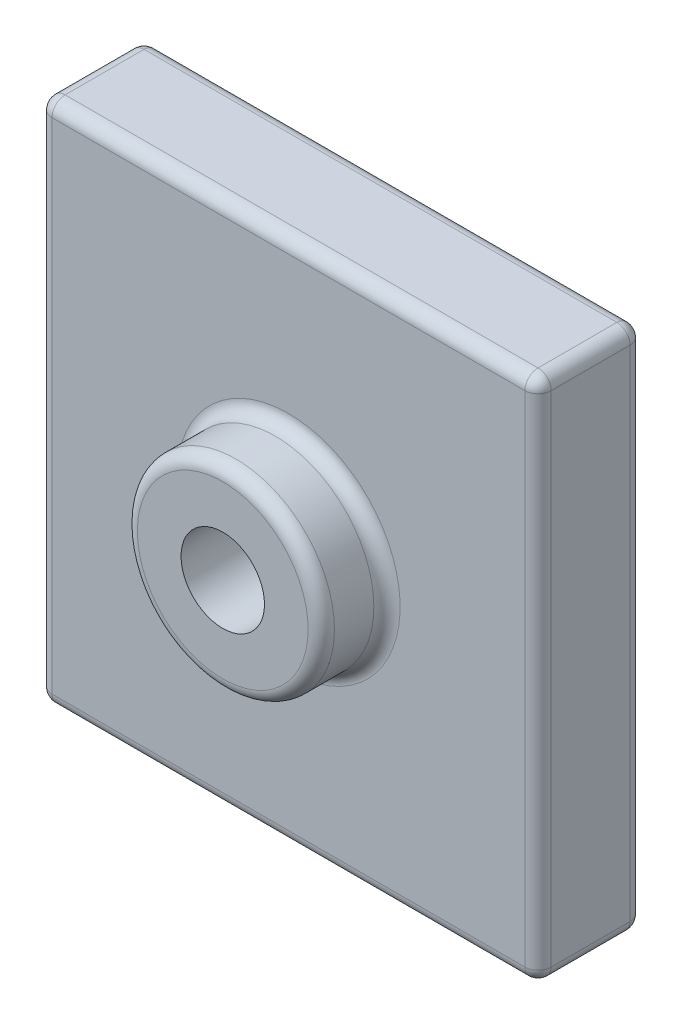
from build123d import *
from build123d.topology import SkipClean

# Parameters (mm, degrees)
SKETCH1_W           = 38
SKETCH1_H           = 40
BOSS_EXTRUDE1_DEPTH = 8
SKETCH2_R           = 7.5
SKETCH2_R_2         = 3.175
BOSS_EXTRUDE2_DEPTH = 5
FILLET1_R           = 1
CUT_EXTRUDE1_DEPTH  = 5.55625
SKETCH4_R           = 3.175
CUT_EXTRUDE2_DEPTH  = 57.683330883


with BuildPart() as part:
    # Sketch1 → Boss-Extrude1 (new body)
    with BuildSketch(Plane.XY):
        with Locations((19, 20)):
            Rectangle(SKETCH1_W, SKETCH1_H)
    extrude(amount=BOSS_EXTRUDE1_DEPTH)

    # Sketch2 → Boss-Extrude2 (add)
    with BuildSketch(Plane.XY.offset(8)):
        with Locations((19, 20)):
            Circle(SKETCH2_R)
        with Locations((19, 20)):
            Circle(SKETCH2_R_2, mode=Mode.SUBTRACT)
    extrude(amount=BOSS_EXTRUDE2_DEPTH)

    # Fillet1
    fillet1_edges = [part.edges().sort_by_distance(p)[0] for p in [
        (38, 20, 8),
        (11.5, 20, 8),
        (11.5, 20, 13),
        (19, 40, 8),
        (0, 20, 8),
        (19, 40, 0),
        (38, 20, 0),
        (19, 0, 0),
        (0, 20, 0),
        (0, 40, 4),
        (38, 40, 4),
        (38, 0, 4),
        (0, 0, 4),
        (19, 0, 8),
    ]]
    fillet(fillet1_edges, radius=FILLET1_R)

    # Sketch3 → Cut-Extrude1 (cut)
    with BuildSketch(Plane(origin=(0, 0, 0), x_dir=(-1, 0, 0), z_dir=(0, 0, -1))):
        Polygon((-15.791953229, 25.5565), (-22.208046771, 25.5565), (-25.416093542, 20), (-22.208046771, 14.4435), (-15.791953229, 14.4435), (-12.583906458, 20), align=None)
    extrude(amount=-CUT_EXTRUDE1_DEPTH, mode=Mode.SUBTRACT)

    # Sketch4 → Cut-Extrude2 (cut, through all)
    with SkipClean():  # the faces are left unmerged after this step: merging them gives an invalid solid
        with BuildSketch(Plane(origin=(0, 0, 0), x_dir=(-1, 0, 0), z_dir=(0, 0, -1))):
            with Locations((-19, 20)):
                Circle(SKETCH4_R)
        extrude(amount=-CUT_EXTRUDE2_DEPTH, mode=Mode.SUBTRACT)


solid = part.part
